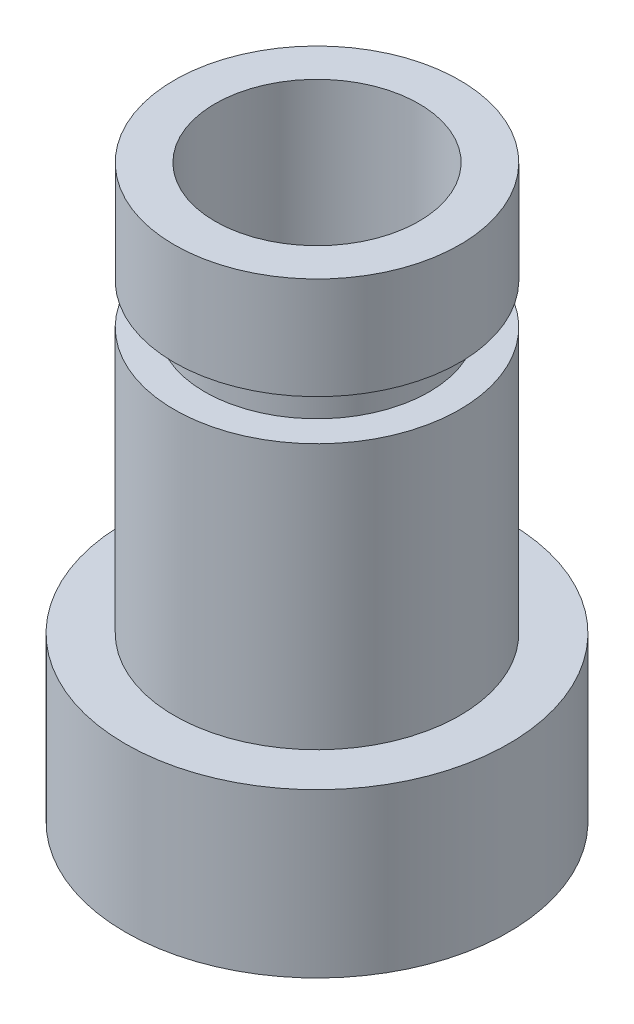
from build123d import *

# Parameters (mm, degrees)
SKETCH1_R           = 4.7
BOSS_EXTRUDE1_DEPTH = 4
SKETCH2_R           = 3.5
BOSS_EXTRUDE2_DEPTH = 6.5
SKETCH3_R           = 2.75
BOSS_EXTRUDE3_DEPTH = 1
SKETCH4_R           = 3.5
BOSS_EXTRUDE4_DEPTH = 2.5
SKETCH5_R           = 2.5
CUT_EXTRUDE1_DEPTH  = 16.497741771


with BuildPart() as part:
    # Sketch1 → Boss-Extrude1 (new body)
    with BuildSketch(Plane(origin=(0, 0, 0), x_dir=(1, 0, 0), z_dir=(0, 1, 0))):
        with Locations(Location((0, 0, 0), (0, 0, 270))):
            Circle(SKETCH1_R)
    extrude(amount=BOSS_EXTRUDE1_DEPTH)

    # Sketch2 → Boss-Extrude2 (add)
    with BuildSketch(Plane(origin=(0, 4, 0), x_dir=(1, 0, 0), z_dir=(0, 1, 0))):
        with Locations(Location((0, 0, 0), (0, 0, 90))):
            Circle(SKETCH2_R)
    extrude(amount=BOSS_EXTRUDE2_DEPTH)

    # Sketch3 → Boss-Extrude3 (add)
    with BuildSketch(Plane(origin=(0, 10.5, 0), x_dir=(1, 0, 0), z_dir=(0, 1, 0))):
        with Locations(Location((0, 0, 0), (0, 0, 270))):
            Circle(SKETCH3_R)
    extrude(amount=BOSS_EXTRUDE3_DEPTH)

    # Sketch4 → Boss-Extrude4 (add)
    with BuildSketch(Plane(origin=(0, 11.5, 0), x_dir=(1, 0, 0), z_dir=(0, 1, 0))):
        with Locations(Location((0, 0, 0), (0, 0, 90))):
            Circle(SKETCH4_R)
    extrude(amount=BOSS_EXTRUDE4_DEPTH)

    # Sketch5 → Cut-Extrude1 (cut, through all)
    with BuildSketch(Plane(origin=(0, 14, 0), x_dir=(1, 0, 0), z_dir=(0, 1, 0))):
        with Locations(Location((0, 0, 0), (0, 0, 270))):
            Circle(SKETCH5_R)
    extrude(amount=-CUT_EXTRUDE1_DEPTH, mode=Mode.SUBTRACT)


solid = part.part
